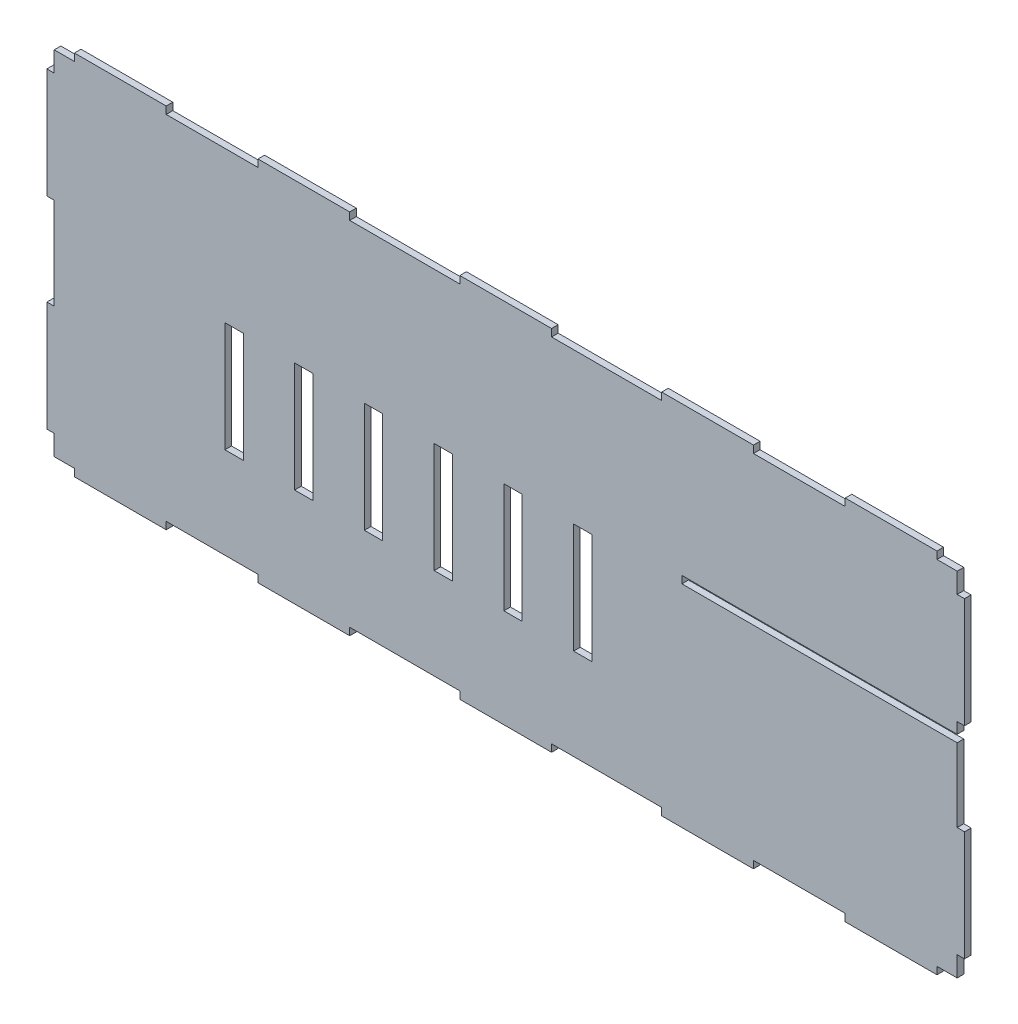
from build123d import *

# Parameters (mm, degrees)
SKETCH_1_W          = 500
SKETCH_1_H          = 200
EXTRUDE_1_DEPTH     = 3.6
SKETCH_3_W          = 4
SKETCH_3_H          = 50
CUT_EXTRUDE_2_DEPTH = 3.6
SKETCH_4_W          = 56.911563003
SKETCH_4_H          = 4
SKETCH_4_W_2        = 50
SKETCH_4_W_3        = 60
SKETCH_4_W_4        = 57.96169575
CUT_EXTRUDE_3_DEPTH = 10
SKETCH_5_W          = 10
SKETCH_5_H          = 60
CUT_EXTRUDE_4_DEPTH = 270.282305397
SKETCH_6_W          = 194.899640321
SKETCH_6_H          = 4
CUT_EXTRUDE_5_DEPTH = 270.282305397


with BuildPart() as part:
    # 草图1 → 凸台-拉伸1 (new body)
    with BuildSketch(Plane.XY):
        Rectangle(SKETCH_1_W, SKETCH_1_H)
    extrude(amount=EXTRUDE_1_DEPTH)

    # 草图3 → 切除-拉伸2 (cut)
    with BuildSketch(Plane.XY.offset(3.6)):
        with Locations((-248, 0)):
            Rectangle(SKETCH_3_W, SKETCH_3_H)
        with Locations((-248, 110)):
            Rectangle(SKETCH_3_W, SKETCH_3_H)
        with Locations((-248, -110)):
            Rectangle(SKETCH_3_W, SKETCH_3_H)
        with Locations((248, 110)):
            Rectangle(SKETCH_3_W, SKETCH_3_H)
        with Locations((248, 0)):
            Rectangle(SKETCH_3_W, SKETCH_3_H)
        with Locations((248, -110)):
            Rectangle(SKETCH_3_W, SKETCH_3_H)
    extrude(amount=-CUT_EXTRUDE_2_DEPTH, mode=Mode.SUBTRACT)

    # 草图4 → 切除-拉伸3 (cut)
    with BuildSketch(Plane.XY.offset(3.6)):
        with Locations((-263.455781502, -98)):
            Rectangle(SKETCH_4_W, SKETCH_4_H)
        with Locations((-160, -98)):
            Rectangle(SKETCH_4_W_2, SKETCH_4_H)
        with Locations((-55, -98)):
            Rectangle(SKETCH_4_W_3, SKETCH_4_H)
        with Locations((55, -98)):
            Rectangle(SKETCH_4_W_3, SKETCH_4_H)
        with Locations((160, -98)):
            Rectangle(SKETCH_4_W_2, SKETCH_4_H)
        with Locations((263.980847875, -98)):
            Rectangle(SKETCH_4_W_4, SKETCH_4_H)
        with Locations((263.980847875, 98)):
            Rectangle(SKETCH_4_W_4, SKETCH_4_H)
        with Locations((160, 98)):
            Rectangle(SKETCH_4_W_2, SKETCH_4_H)
        with Locations((55, 98)):
            Rectangle(SKETCH_4_W_3, SKETCH_4_H)
        with Locations((-55, 98)):
            Rectangle(SKETCH_4_W_3, SKETCH_4_H)
        with Locations((-160, 98)):
            Rectangle(SKETCH_4_W_2, SKETCH_4_H)
        with Locations((-263.455781502, 98)):
            Rectangle(SKETCH_4_W, SKETCH_4_H)
    extrude(amount=-CUT_EXTRUDE_3_DEPTH, mode=Mode.SUBTRACT)

    # 草图5 → 切除-拉伸4 (cut, through all)
    with BuildSketch(Plane.XY.offset(3.6)):
        with Locations((-148, -16.237417244)):
            Rectangle(SKETCH_5_W, SKETCH_5_H)
        with Locations((-110, -16.237417244)):
            Rectangle(SKETCH_5_W, SKETCH_5_H)
        with Locations((-72, -16.237417244)):
            Rectangle(SKETCH_5_W, SKETCH_5_H)
        with Locations((-34, -16.237417244)):
            Rectangle(SKETCH_5_W, SKETCH_5_H)
        with Locations((4, -16.237417244)):
            Rectangle(SKETCH_5_W, SKETCH_5_H)
        with Locations((42, -16.237417244)):
            Rectangle(SKETCH_5_W, SKETCH_5_H)
    extrude(amount=-CUT_EXTRUDE_4_DEPTH, mode=Mode.SUBTRACT)

    # 草图6 → 切除-拉伸5 (cut, through all)
    with BuildSketch(Plane.XY.offset(3.6)):
        with Locations((193.44982016, 17)):
            Rectangle(SKETCH_6_W, SKETCH_6_H)
    extrude(amount=-CUT_EXTRUDE_5_DEPTH, mode=Mode.SUBTRACT)


solid = part.part
